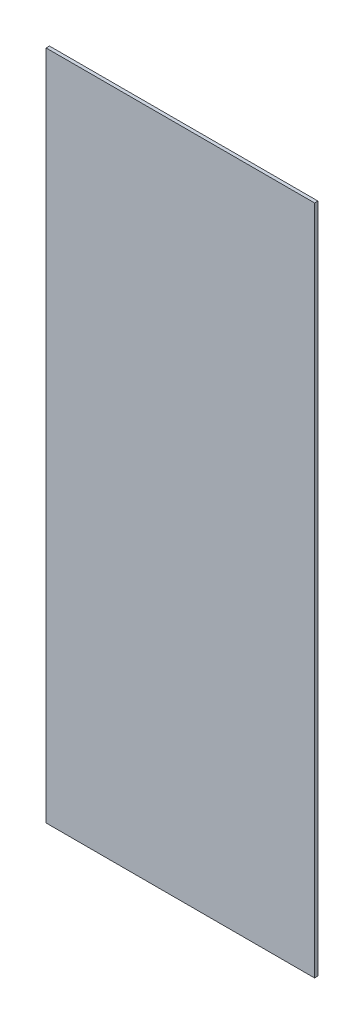
from build123d import *

# Parameters (mm, degrees)
SKETCH1_W           = 160
SKETCH1_H           = 400
BOSS_EXTRUDE1_DEPTH = 2


with BuildPart() as part:
    # Sketch1 → Boss-Extrude1 (new body)
    with BuildSketch(Plane.XY):
        Rectangle(SKETCH1_W, SKETCH1_H)
    extrude(amount=BOSS_EXTRUDE1_DEPTH)


solid = part.part
